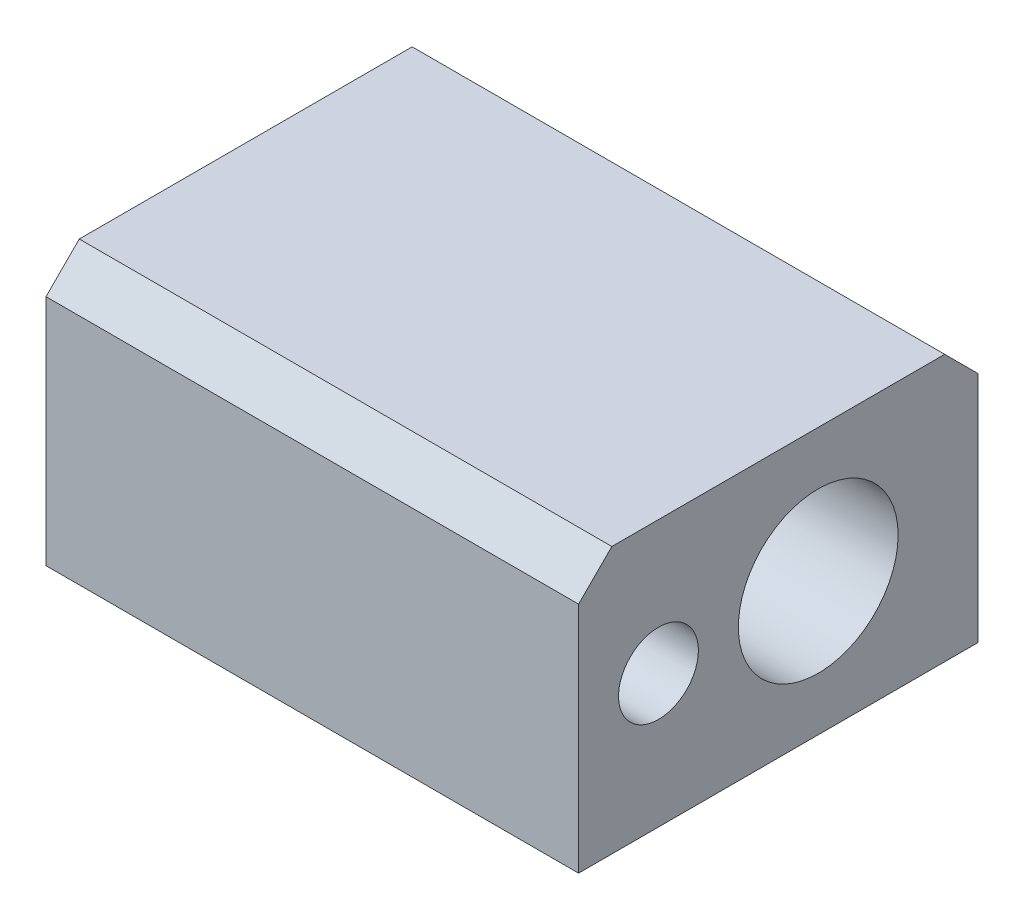
from build123d import *

# Parameters (mm, degrees)
SKETCH1_W           = 50.8
SKETCH1_H           = 76.2
SKETCH1_R           = 15.24
SKETCH1_R_2         = 7.62
BOSS_EXTRUDE1_DEPTH = 101.6
CHAMFER1_SIZE       = 6.35


with BuildPart() as part:
    # Sketch1 → Boss-Extrude1 (new body)
    with BuildSketch(Plane.YZ):
        Rectangle(SKETCH1_W, SKETCH1_H)
        with Locations(Location((0, -7.62, 0), (0, 0, 270))):
            Circle(SKETCH1_R, mode=Mode.SUBTRACT)
        with Locations(Location((0, 22.86, 0), (0, 0, 270))):
            Circle(SKETCH1_R_2, mode=Mode.SUBTRACT)
    extrude(amount=BOSS_EXTRUDE1_DEPTH)

    # Chamfer1
    chamfer1_edges = [part.edges().sort_by_distance(p)[0] for p in [
        (50.8, 25.4, 38.1),
        (50.8, 25.4, -38.1),
    ]]
    chamfer(chamfer1_edges, length=CHAMFER1_SIZE)


solid = part.part
